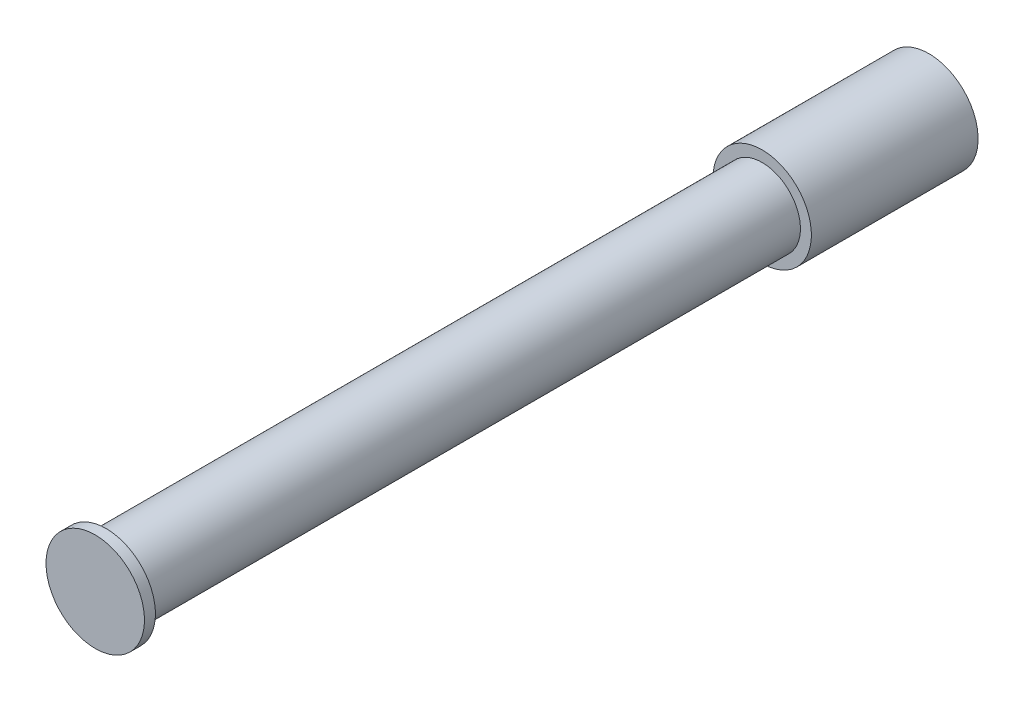
from build123d import *

# Parameters (mm, degrees)
SKETCH1_R           = 2.25
BOSS_EXTRUDE1_DEPTH = 38.1
CUT_EXTRUDE1_START  = -7.62
SKETCH3_OUTSIDE_W   = 14.226
SKETCH3_OUTSIDE_H   = 14.226
SKETCH3_OUTSIDE_R   = 1.75
CUT_EXTRUDE1_DEPTH  = 29.98


with BuildPart() as part:
    # Sketch1 → Boss-Extrude1 (new body)
    with BuildSketch(Plane.XY):
        with Locations(Location((0, 5.826393973, 0), (0, 0, 180))):
            Circle(SKETCH1_R)
    extrude(amount=BOSS_EXTRUDE1_DEPTH)

    # Sketch3 outside → Cut-Extrude1 (cut)
    with BuildSketch(Plane(origin=(0, 0, 0), x_dir=(-1, 0, 0), z_dir=(0, 0, -1)).offset(CUT_EXTRUDE1_START)):
        with Locations((0, 5.826)):
            Rectangle(SKETCH3_OUTSIDE_W, SKETCH3_OUTSIDE_H)
        with Locations((0, 5.826393973)):
            Circle(SKETCH3_OUTSIDE_R, mode=Mode.SUBTRACT)
    extrude(amount=-CUT_EXTRUDE1_DEPTH, mode=Mode.SUBTRACT)


solid = part.part
